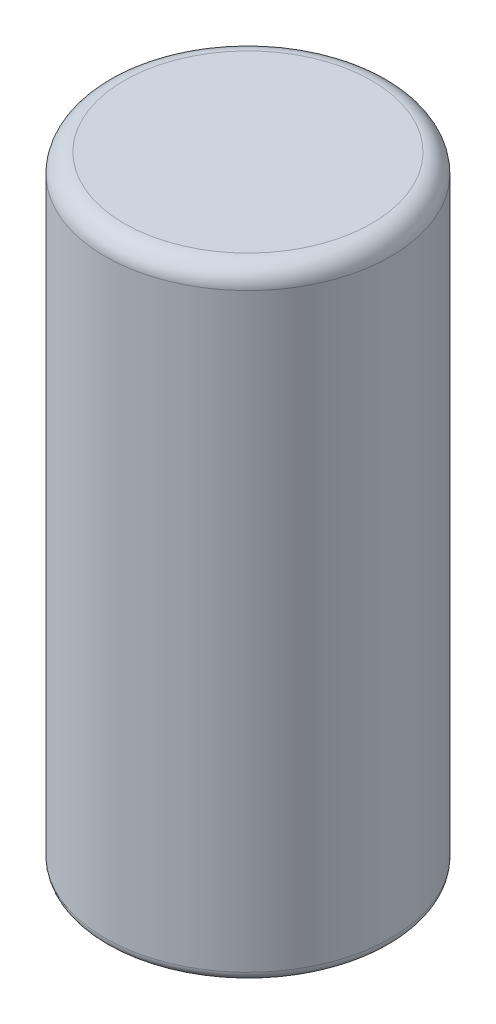
from build123d import *

# Parameters (mm, degrees)
SKETCH1_R                     = 15
BOSS_EXTRUDE1_DEPTH           = 65
FILLET1_R                     = 2
FILLET2_R                     = 1
SKETCH2_R                     = 2
BOSS_EXTRUDE2_DEPTH           = 5
BOSS_EXTRUDE2_DRAFT           = 16
BOSS_EXTRUDE2_PROFILE_2_DEPTH = 5
BOSS_EXTRUDE2_PROFILE_2_DRAFT = 16


with BuildPart() as part:
    # Sketch1 → Boss-Extrude1 (new body)
    with BuildSketch(Plane(origin=(0, 0, 0), x_dir=(1, 0, 0), z_dir=(0, 1, 0))):
        with Locations(Location((0, 0, 0), (0, 0, 270))):
            Circle(SKETCH1_R)
    extrude(amount=BOSS_EXTRUDE1_DEPTH)

    # Fillet1
    fillet1_edges = [part.edges().sort_by_distance(p)[0] for p in [
        (0, 65, -15),
    ]]
    fillet(fillet1_edges, radius=FILLET1_R)

    # Fillet2
    fillet2_edges = [part.edges().sort_by_distance(p)[0] for p in [
        (0, 0, -15),
    ]]
    fillet(fillet2_edges, radius=FILLET2_R)


with BuildPart() as boss_extrude2_tool:
    # Sketch2 → Boss-Extrude2 (with draft: the straight prism first)
    with BuildSketch(Plane(origin=(0, 0, 0), x_dir=(-1, 0, 0), z_dir=(0, -1, 0))):
        with Locations((6, 0)):
            Circle(SKETCH2_R)
    extrude(amount=BOSS_EXTRUDE2_DEPTH)
    # Boss-Extrude2: the draft: its side faces are tilted about the plane it starts from
    boss_extrude2_sides = [boss_extrude2_tool.faces().sort_by_distance(p)[0] for p in [
        (-4, -2.5, 0),
    ]]
    draft(boss_extrude2_sides, Plane(origin=(0, 0, 0), x_dir=(-1, 0, 0), z_dir=(0, -1, 0)), BOSS_EXTRUDE2_DRAFT)


with BuildPart() as part_1:
    add(part.part)

    # Boss-Extrude2: add boss_extrude2_tool
    add(boss_extrude2_tool.part)


with BuildPart() as boss_extrude2_profile_2_tool:
    # Sketch2 → Boss-Extrude2 profile 2 (with draft: the straight prism first)
    with BuildSketch(Plane(origin=(0, 0, 0), x_dir=(-1, 0, 0), z_dir=(0, -1, 0))):
        with Locations((-6, 0)):
            Circle(SKETCH2_R)
    extrude(amount=BOSS_EXTRUDE2_PROFILE_2_DEPTH)
    # Boss-Extrude2 profile 2: the draft: its side faces are tilted about the plane it starts from
    boss_extrude2_profile_2_sides = [boss_extrude2_profile_2_tool.faces().sort_by_distance(p)[0] for p in [
        (8, -2.5, 0),
    ]]
    draft(boss_extrude2_profile_2_sides, Plane(origin=(0, 0, 0), x_dir=(-1, 0, 0), z_dir=(0, -1, 0)), BOSS_EXTRUDE2_PROFILE_2_DRAFT)


with BuildPart() as part_2:
    add(part_1.part)

    # Boss-Extrude2 profile 2: add boss_extrude2_profile_2_tool
    add(boss_extrude2_profile_2_tool.part)


solid = part_2.part
